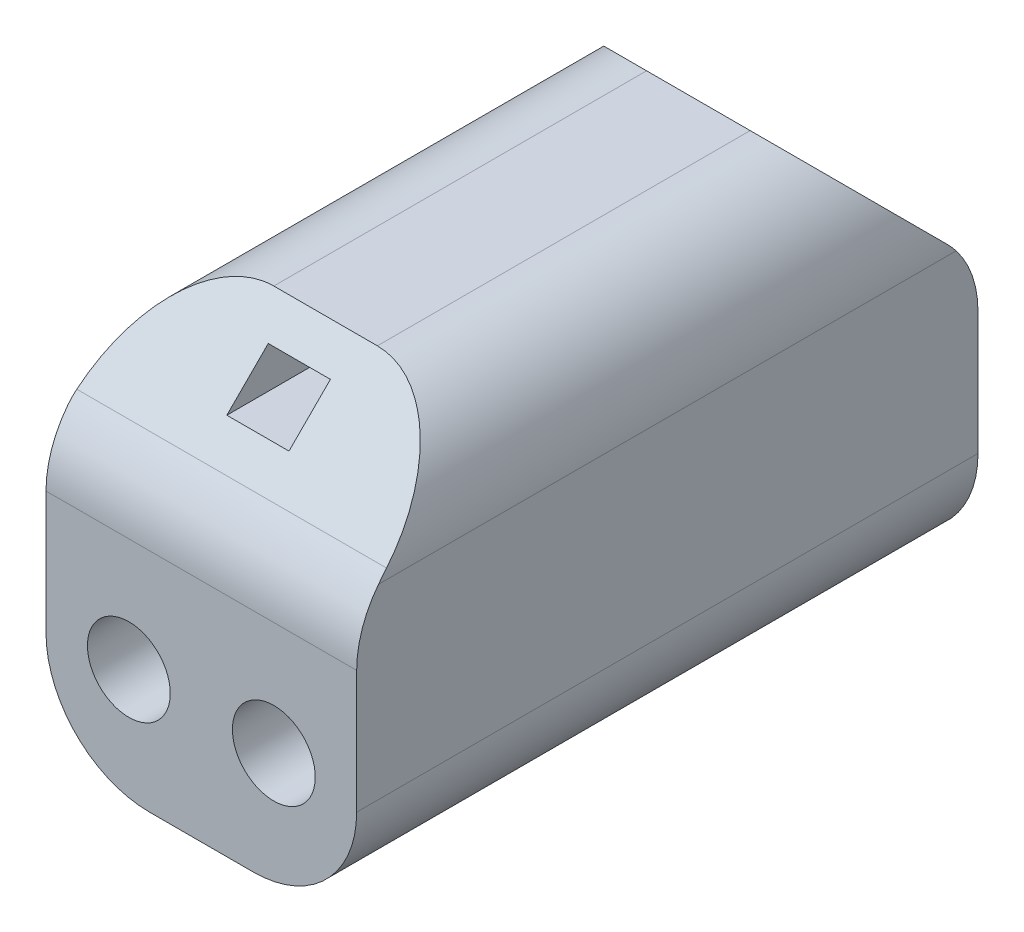
from build123d import *

# Parameters (mm, degrees)
BOSS_EXTRUDE2_DEPTH = 7.5
FILLET2_R           = 5
SKETCH4_R           = 2
SKETCH4_W           = 3
SKETCH4_H           = 2
CUT_EXTRUDE1_DEPTH  = 100
FILLET3_R           = 5
FILLET4_R           = 5


with BuildPart() as part:
    # Sketch2 → Boss-Extrude2 (new, symmetric)
    with BuildSketch(Plane(origin=(0, 0, 0), x_dir=(0, 0, -1), z_dir=(1, 0, 0))):
        Polygon((-7.967160281, -29.21673477), (-7.967160281, -16.21673477), (-1.967160281, -10.21673477), (16.032839719, -10.21673477), (22.032839719, -16.21673477), (22.032839719, -29.21673477), align=None)
    extrude(amount=BOSS_EXTRUDE2_DEPTH, both=True)

    # Fillet2
    fillet2_edges = [part.edges().sort_by_distance(p)[0] for p in [
        (0, -16.21673477, 7.967160281),
        (0, -16.21673477, -22.032839719),
    ]]
    fillet(fillet2_edges, radius=FILLET2_R)

    # Sketch4 → Cut-Extrude1 (cut, symmetric)
    with BuildSketch(Plane.XY):
        with Locations(Location((-3.5, -23.752268676, 0), (0, 0, 90))):
            Circle(SKETCH4_R)
        with Locations(Location((3.5, -23.752268676, 0), (0, 0, 90))):
            Circle(SKETCH4_R)
        with Locations((0, -12.484501723)):
            Rectangle(SKETCH4_W, SKETCH4_H)
    extrude(amount=CUT_EXTRUDE1_DEPTH, both=True, mode=Mode.SUBTRACT)

    # Fillet3
    fillet3_edges = [part.edges().sort_by_distance(p)[0] for p in [
        (7.5, -29.21673477, -7.032839719),
        (-7.5, -29.21673477, -7.032839719),
    ]]
    fillet(fillet3_edges, radius=FILLET3_R)

    # Fillet4
    fillet4_edges = [part.edges().sort_by_distance(p)[0] for p in [
        (7.5, -10.21673477, -7.032839719),
        (-7.5, -10.21673477, -7.032839719),
    ]]
    fillet(fillet4_edges, radius=FILLET4_R)


solid = part.part
